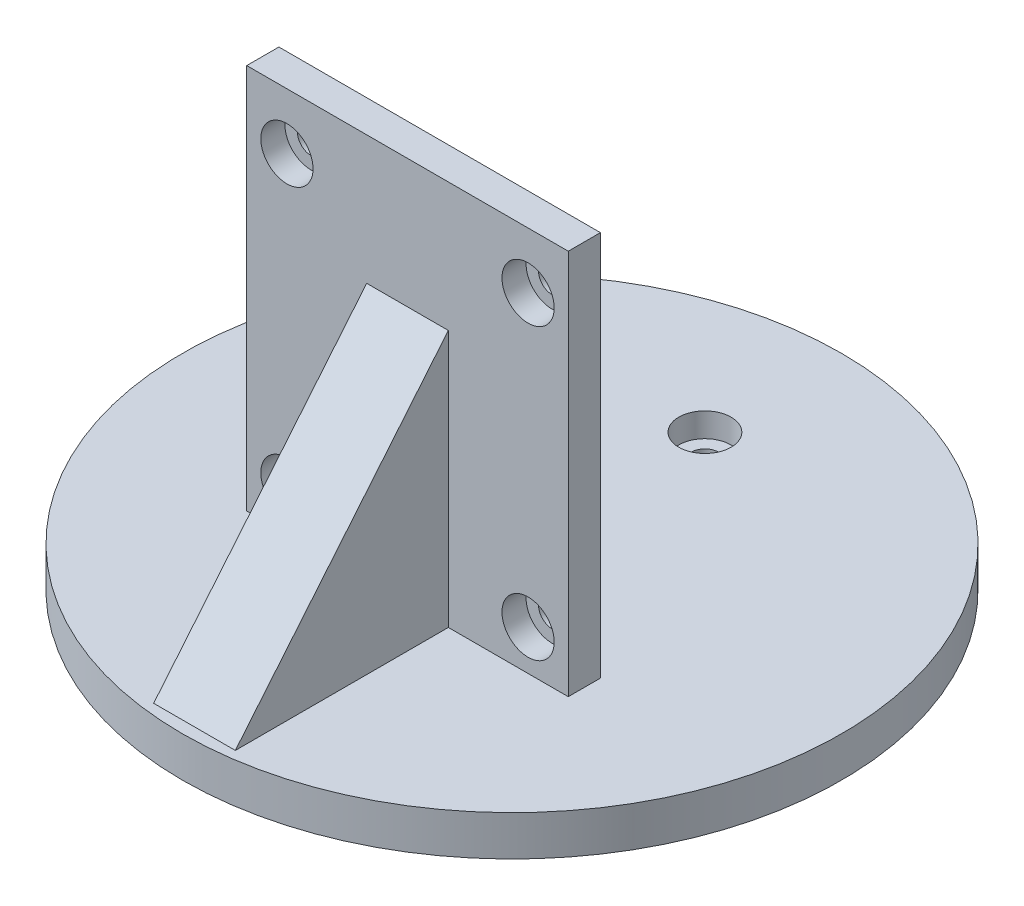
from build123d import *

# Parameters (mm, degrees)
SKETCH1_R                                    = 41
BOSS_EXTRUDE1_DEPTH                          = 5
BOSS_EXTRUDE2_DEPTH                          = 5.08
BOSS_EXTRUDE2_DEPTH_BACK                     = 5.08
SKETCH7_W                                    = 40
SKETCH7_H                                    = 48
BOSS_EXTRUDE3_DEPTH                          = 4
CBORE_FOR_M5_HEX_HEAD_CAP_SCREW5_D           = 3.4
CBORE_FOR_M5_HEX_HEAD_CAP_SCREW5_DEPTH       = 5.5
CBORE_FOR_M5_HEX_HEAD_CAP_SCREW5_CBORE_D     = 6.5
CBORE_FOR_M5_HEX_HEAD_CAP_SCREW5_CBORE_DEPTH = 3
CBORE_FOR_M5_HEX_HEAD_CAP_SCREW5_TIP         = 1.021463052
SKETCH22_W                                   = 4
SKETCH22_H                                   = 10
BOSS_EXTRUDE4_DEPTH                          = 2
BOSS_EXTRUDE5_DEPTH                          = 10
CBORE_FOR_M5_HEX_HEAD_CAP_SCREW6_D           = 3.4
CBORE_FOR_M5_HEX_HEAD_CAP_SCREW6_DEPTH       = 5.5
CBORE_FOR_M5_HEX_HEAD_CAP_SCREW6_CBORE_D     = 6.5
CBORE_FOR_M5_HEX_HEAD_CAP_SCREW6_CBORE_DEPTH = 3
CBORE_FOR_M5_HEX_HEAD_CAP_SCREW6_TIP         = 1.021463052


with BuildPart() as part:
    # Sketch1 → Boss-Extrude1 (new body)
    with BuildSketch(Plane(origin=(0, 0, 0), x_dir=(1, 0, 0), z_dir=(0, 1, 0))):
        with Locations(Location((0, 0, 0), (0, 0, 270))):
            Circle(SKETCH1_R)
    extrude(amount=BOSS_EXTRUDE1_DEPTH)

    # Sketch6 → Boss-Extrude2 (add, two sides: drawn at the far end of the back side and taken through both)
    with BuildSketch(Plane(origin=(0, 0, 0), x_dir=(0, 0, -1), z_dir=(1, 0, 0)).offset(-BOSS_EXTRUDE2_DEPTH_BACK)):
        Polygon((-13, 5), (-39.5, 5), (-13, 37), align=None)
    extrude(amount=BOSS_EXTRUDE2_DEPTH + BOSS_EXTRUDE2_DEPTH_BACK)

    # Sketch7 → Boss-Extrude3 (add)
    with BuildSketch(Plane(origin=(0, 0, 13), x_dir=(-1, 0, 0), z_dir=(0, 0, -1))):
        with Locations((0, 29)):
            Rectangle(SKETCH7_W, SKETCH7_H)
    extrude(amount=BOSS_EXTRUDE3_DEPTH)

    # CBORE for M5 Hex Head Cap Screw5
    with Locations(Plane(origin=(0, 5, 0), x_dir=(1, 0, 0), z_dir=(0, 1, 0))):
        with Locations((0, 0), (0, 24)):
            CounterBoreHole(CBORE_FOR_M5_HEX_HEAD_CAP_SCREW5_D / 2, CBORE_FOR_M5_HEX_HEAD_CAP_SCREW5_CBORE_D / 2, CBORE_FOR_M5_HEX_HEAD_CAP_SCREW5_CBORE_DEPTH, depth=CBORE_FOR_M5_HEX_HEAD_CAP_SCREW5_DEPTH)
            with Locations((0, 0, -(CBORE_FOR_M5_HEX_HEAD_CAP_SCREW5_DEPTH + CBORE_FOR_M5_HEX_HEAD_CAP_SCREW5_TIP / 2))):  # 118° drill point
                Cone(0, CBORE_FOR_M5_HEX_HEAD_CAP_SCREW5_D / 2, CBORE_FOR_M5_HEX_HEAD_CAP_SCREW5_TIP, mode=Mode.SUBTRACT)

    # Sketch22 → Boss-Extrude4 (add)
    with BuildSketch(Plane(origin=(0, 5, 0), x_dir=(1, 0, 0), z_dir=(0, 1, 0))):
        with Locations((-17, 6)):
            Rectangle(SKETCH22_W, SKETCH22_H)
    extrude(amount=BOSS_EXTRUDE4_DEPTH)

    # Sketch23 → Boss-Extrude5 (add)
    with BuildSketch(Plane(origin=(0, 0, -11), x_dir=(-1, 0, 0), z_dir=(0, 0, -1))):
        Polygon((14.171572875, 5), (15.33137085, 7.8), (19, 7.8), (19, 5), align=None)
    extrude(amount=-BOSS_EXTRUDE5_DEPTH)

    # CBORE for M5 Hex Head Cap Screw6
    with Locations(Plane.XY.offset(13)):
        with Locations((15, 10), (-15, 10), (-15, 46), (15, 46)):
            CounterBoreHole(CBORE_FOR_M5_HEX_HEAD_CAP_SCREW6_D / 2, CBORE_FOR_M5_HEX_HEAD_CAP_SCREW6_CBORE_D / 2, CBORE_FOR_M5_HEX_HEAD_CAP_SCREW6_CBORE_DEPTH, depth=CBORE_FOR_M5_HEX_HEAD_CAP_SCREW6_DEPTH)
            with Locations((0, 0, -(CBORE_FOR_M5_HEX_HEAD_CAP_SCREW6_DEPTH + CBORE_FOR_M5_HEX_HEAD_CAP_SCREW6_TIP / 2))):  # 118° drill point
                Cone(0, CBORE_FOR_M5_HEX_HEAD_CAP_SCREW6_D / 2, CBORE_FOR_M5_HEX_HEAD_CAP_SCREW6_TIP, mode=Mode.SUBTRACT)


solid = part.part
